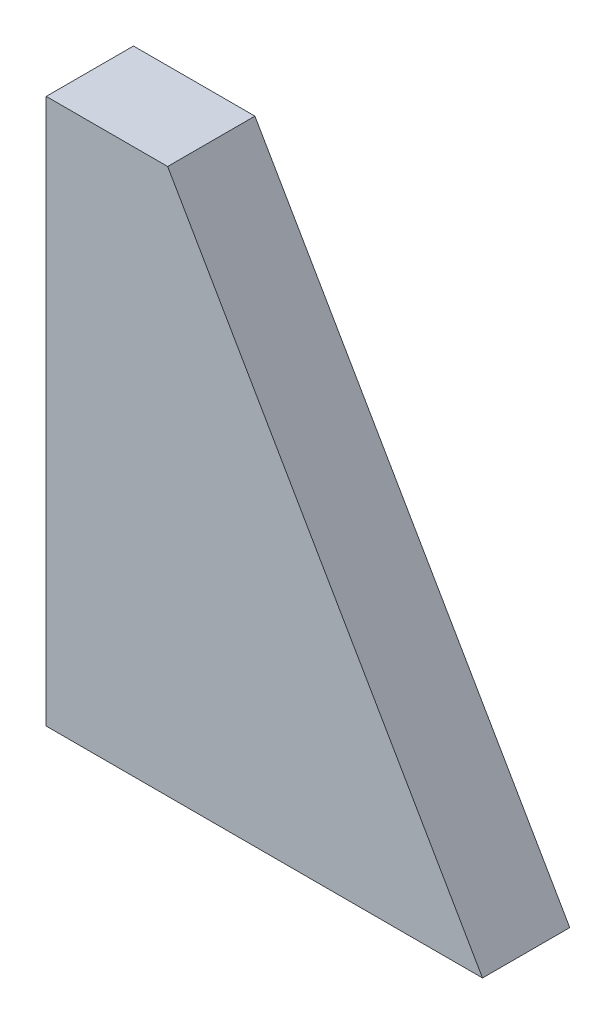
from build123d import *

# Parameters (mm, degrees)
BOSS_EXTRUDE1_DEPTH = 8


with BuildPart() as part:
    # Sketch1 → Boss-Extrude1 (new body)
    with BuildSketch(Plane.XY):
        Polygon((-20, -25), (20, -25), (-8.867513459, 25), (-20, 25), align=None)
    extrude(amount=BOSS_EXTRUDE1_DEPTH)


solid = part.part
